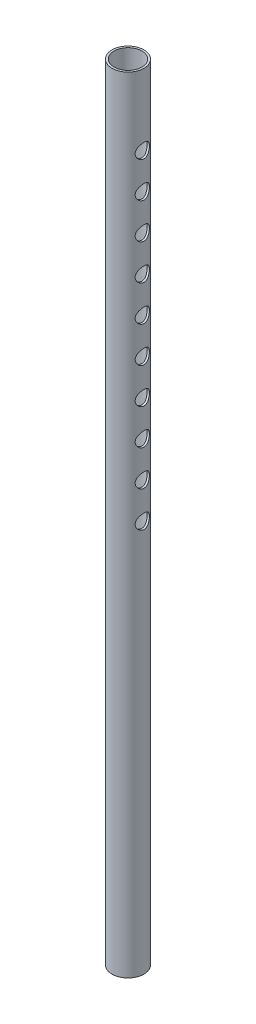
from build123d import *

# Parameters (mm, degrees)
SKETCH_2_R               = 11.2
SKETCH_2_R_2             = 9.775
CUT_EXTRUDE_1_DEPTH      = 551.228025459
CUT_EXTRUDE_1_DEPTH_BACK = 551.228025459
SKETCH_3_R               = 5


with BuildPart() as part:
    # По траектории1: sweep along a path in Эскиз1
    with BuildLine(Plane.XY) as sweep_1_path:
        Line((0, 0), (0, -550))
    # Эскиз2 → По траектории1 (sweep)
    with BuildSketch(Plane(origin=(0, 0, 0), x_dir=(1, 0, 0), z_dir=(0, 1, 0))):
        Circle(SKETCH_2_R)
        Circle(SKETCH_2_R_2, mode=Mode.SUBTRACT)
    sweep(path=sweep_1_path.line)

    # Эскиз3 → Вырез-Вытянуть1 (cut, two sides: drawn at the far end of the back side and taken through both)
    with BuildSketch(Plane(origin=(0, 0, 0), x_dir=(0, 0, -1), z_dir=(1, 0, 0)).offset(-CUT_EXTRUDE_1_DEPTH_BACK)):
        with Locations((0, -50)):
            Circle(SKETCH_3_R)
        with Locations((0, -75)):
            Circle(SKETCH_3_R)
        with Locations((0, -100)):
            Circle(SKETCH_3_R)
        with Locations((0, -125)):
            Circle(SKETCH_3_R)
        with Locations((0, -150)):
            Circle(SKETCH_3_R)
        with Locations((0, -175)):
            Circle(SKETCH_3_R)
        with Locations((0, -200)):
            Circle(SKETCH_3_R)
        with Locations((0, -225)):
            Circle(SKETCH_3_R)
        with Locations((0, -250)):
            Circle(SKETCH_3_R)
        with Locations((0, -275)):
            Circle(SKETCH_3_R)
    extrude(amount=CUT_EXTRUDE_1_DEPTH + CUT_EXTRUDE_1_DEPTH_BACK, mode=Mode.SUBTRACT)


solid = part.part
